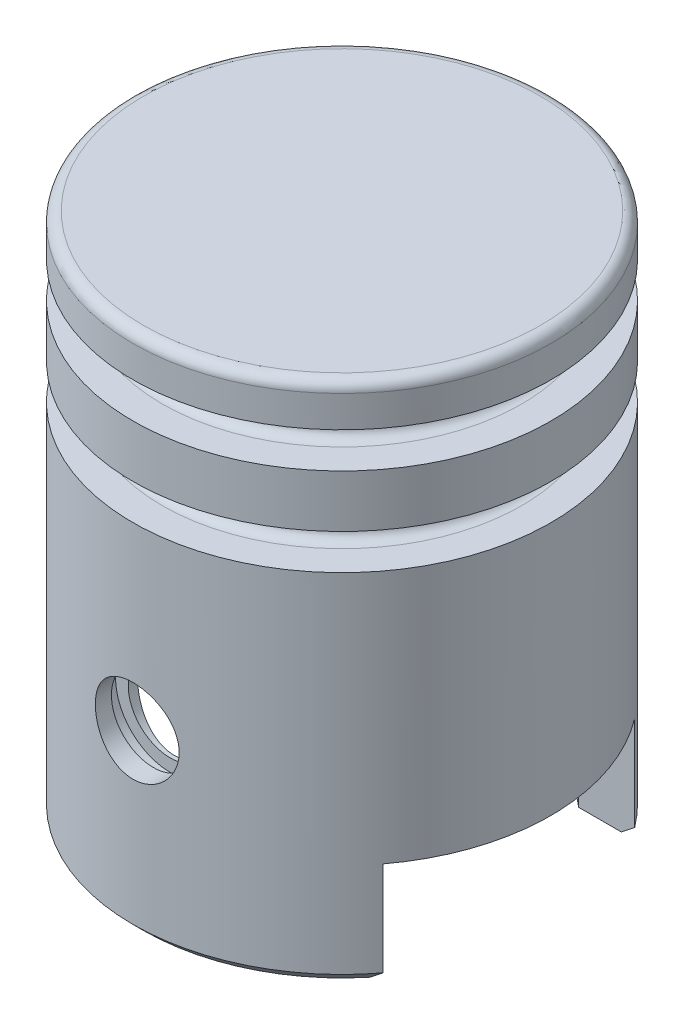
from build123d import *

# Parameters (mm, degrees)
SKETCH_1_R               = 9.97
EXTRUDE_1_DEPTH          = 25
FILLET_1_R               = 0.5
SKETCH_2_W               = 1.9
SKETCH_2_H               = 1.7
FILLET_2_R               = 0.5
CUT_EXTRUDE_1_DEPTH      = 29.701947669
CUT_EXTRUDE_1_DEPTH_BACK = 29.701947669
SKETCH_4_R               = 2
CUT_EXTRUDE_START        = 9
SKETCH_6_R               = 2.6
SKETCH_6_R_2             = 2
CUT_EXTRUDE_3_DEPTH      = 0.8
CHAMFER_1_SIZE           = 0.5
CUT_EXTRUDE_4_DEPTH      = 29.701947739
CUT_EXTRUDE_4_DEPTH_BACK = 29.701947739
SKETCH_7_W               = 12
SKETCH_7_H               = 5
CUT_EXTRUDE_START_2      = 5
SKETCH_8_R               = 8
CUT_EXTRUDE_5_DEPTH      = 24


with BuildPart() as part:
    # 草图1 → 凸台-拉伸1 (new body)
    with BuildSketch(Plane(origin=(0, 0, 0), x_dir=(1, 0, 0), z_dir=(0, 1, 0))):
        Circle(SKETCH_1_R)
    extrude(amount=EXTRUDE_1_DEPTH)

    # 圆角1
    fillet_1_edges = [part.edges().sort_by_distance(p)[0] for p in [
        (-9.97, 25, 0),
    ]]
    fillet(fillet_1_edges, radius=FILLET_1_R)

    # 草图2 → 切除-旋转1 (revolve, cut)
    with BuildSketch(Plane.XY):
        with Locations((-9.02, 22.15)):
            Rectangle(SKETCH_2_W, SKETCH_2_H)
        with Locations((-9.02, 17.95)):
            Rectangle(SKETCH_2_W, SKETCH_2_H)
    revolve(axis=Axis((0, 0, 0), (0, 1, 0)), mode=Mode.SUBTRACT)

    # 圆角2
    fillet_2_edges = [part.edges().sort_by_distance(p)[0] for p in [
        (8.07, 17.1, 0),
        (8.07, 18.8, 0),
        (8.07, 21.3, 0),
        (8.07, 23, 0),
    ]]
    fillet(fillet_2_edges, radius=FILLET_2_R)

    # 草图4 → 切除-拉伸1 (cut, two sides: drawn at the far end of the back side and taken through both)
    with BuildSketch(Plane.XY.offset(-CUT_EXTRUDE_1_DEPTH_BACK)):
        with Locations((0, 8.5)):
            Circle(SKETCH_4_R)
    extrude(amount=CUT_EXTRUDE_1_DEPTH + CUT_EXTRUDE_1_DEPTH_BACK, mode=Mode.SUBTRACT)

    # 草图6 → 切除-拉伸3 (cut)
    with BuildSketch(Plane.XY.offset(CUT_EXTRUDE_START)):
        with Locations((0, 8.5)):
            Circle(SKETCH_6_R)
        with Locations((0, 8.5)):
            Circle(SKETCH_6_R_2, mode=Mode.SUBTRACT)
    cut_extrude_3 = extrude(amount=-CUT_EXTRUDE_3_DEPTH, mode=Mode.SUBTRACT)

    # 镜向1: 切除-拉伸3 across plane
    add(cut_extrude_3.mirror(Plane.XY), mode=Mode.SUBTRACT)

    # 倒角1
    chamfer_1_edges = [part.edges().sort_by_distance(p)[0] for p in [
        (-9.97, 0, 0),
    ]]
    chamfer(chamfer_1_edges, length=CHAMFER_1_SIZE)

    # 草图7 → 切除-拉伸4 (cut, two sides: drawn at the far end of the back side and taken through both)
    with BuildSketch(Plane(origin=(0, 0, 0), x_dir=(0, 0, -1), z_dir=(1, 0, 0)).offset(-CUT_EXTRUDE_4_DEPTH_BACK)):
        with Locations((0, 2.5)):
            Rectangle(SKETCH_7_W, SKETCH_7_H)
    extrude(amount=CUT_EXTRUDE_4_DEPTH + CUT_EXTRUDE_4_DEPTH_BACK, mode=Mode.SUBTRACT)

    # 草图8 → 切除-拉伸5 (cut)
    with BuildSketch(Plane.XZ.offset(-5).offset(CUT_EXTRUDE_START_2)):
        Circle(SKETCH_8_R)
    extrude(amount=-CUT_EXTRUDE_5_DEPTH, mode=Mode.SUBTRACT)


solid = part.part
